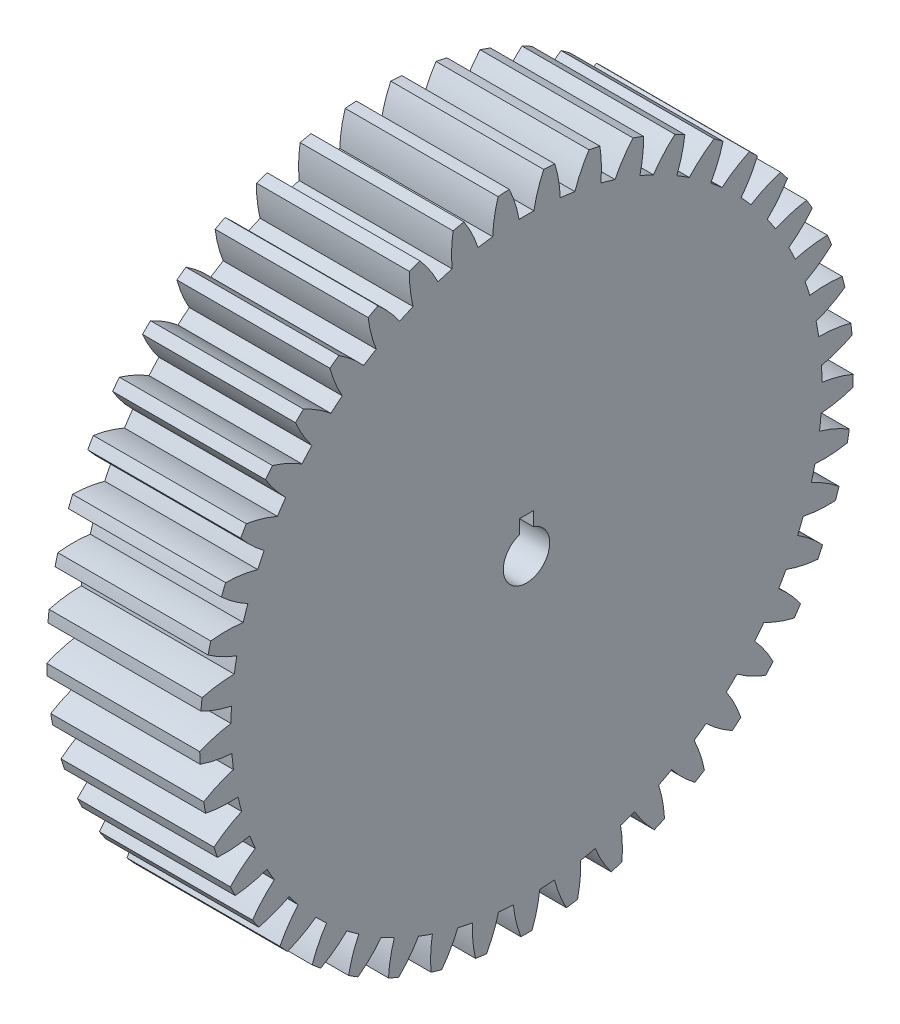
from build123d import *

# Parameters (mm, degrees)
BASPROSKE_W             = 16.5
BASPROSKE_H             = 35.25
TOOTHCUT_DEPTH          = 53.510713193
TEETHCUTS_COUNT         = 45
TEETHCUTS_ANGLE         = 352
BORSKE_R                = 0.4
BORE_DEPTH              = 50.0000508
CROQUIS2_R              = 10
SALIENTE_EXTRUIR1_DEPTH = 10
CORTAR_EXTRUIR1_DEPTH   = 57.453352979


with BuildPart() as part:
    # BasProSke → Base-Revolve (revolve)
    with BuildSketch(Plane(origin=(0, 0, 0), x_dir=(1, 0, 0), z_dir=(0, 1, 0)), mode=Mode.PRIVATE) as base_revolve_sk:
        with Locations((8.25, 17.625)):
            Rectangle(BASPROSKE_W, BASPROSKE_H)
    revolve(base_revolve_sk.sketch.rotate(Axis((-10, 0, 0), (1, 0, 0)), 180), axis=Axis((-10, 0, 0), (1, 0, 0)))

    # TooCutSke → ToothCut (cut, through all)
    with BuildSketch(Plane(origin=(0, 0, 0), x_dir=(0, 0, -1), z_dir=(1, 0, 0))):
        with BuildLine():
            ThreePointArc((0.79804323, 31.864007956), (0, 31.874), (-0.79804323, 31.864007956))
            ThreePointArc((-0.79804323, 31.864007956), (-1.22317485, 33.580067725), (-1.868910813, 35.225857229))
            ThreePointArc((-1.868910813, 35.225857229), (0, 35.2754), (1.868910813, 35.225857229))
            ThreePointArc((1.868910813, 35.225857229), (1.22317485, 33.580067725), (0.79804323, 31.864007956))
        make_face()
    toothcut = extrude(amount=TOOTHCUT_DEPTH, mode=Mode.SUBTRACT)

    # TeethCuts: ToothCut ×45 about axis
    teethcuts_axis = Axis((-10, 0, 0), (1, 0, 0))
    for i in range(1, TEETHCUTS_COUNT):
        add(toothcut.rotate(teethcuts_axis, i * TEETHCUTS_ANGLE / (TEETHCUTS_COUNT - 1)), mode=Mode.SUBTRACT)

    # BorSke → Bore (cut, symmetric)
    with BuildSketch(Plane(origin=(0, 0, 0), x_dir=(0, 0, -1), z_dir=(1, 0, 0))):
        with Locations(Location((0, 0, 0), (0, 0, 180))):
            Circle(BORSKE_R)
    extrude(amount=BORE_DEPTH, both=True, mode=Mode.SUBTRACT)

    # Croquis2 → Saliente-Extruir1 (add)
    with BuildSketch(Plane.ZY):
        with Locations(Location((0, 0, 0), (0, 0, 180))):
            Circle(CROQUIS2_R)
    extrude(amount=SALIENTE_EXTRUIR1_DEPTH)

    # Croquis1 → Cortar-Extruir1 (cut, through all)
    with BuildSketch(Plane(origin=(16.5, 0, 0), x_dir=(0, 0, -1), z_dir=(1, 0, 0))):
        with BuildLine():
            Line((-0.75, 3.884848004), (0.75, 3.884848004))
            Line((0.75, 3.884848004), (0.75, 2.384848004))
            ThreePointArc((0.75, 2.384848004), (0, -2.5), (-0.75, 2.384848004))
            Line((-0.75, 2.384848004), (-0.75, 3.884848004))
        make_face()
    extrude(amount=-CORTAR_EXTRUIR1_DEPTH, mode=Mode.SUBTRACT)


solid = part.part
